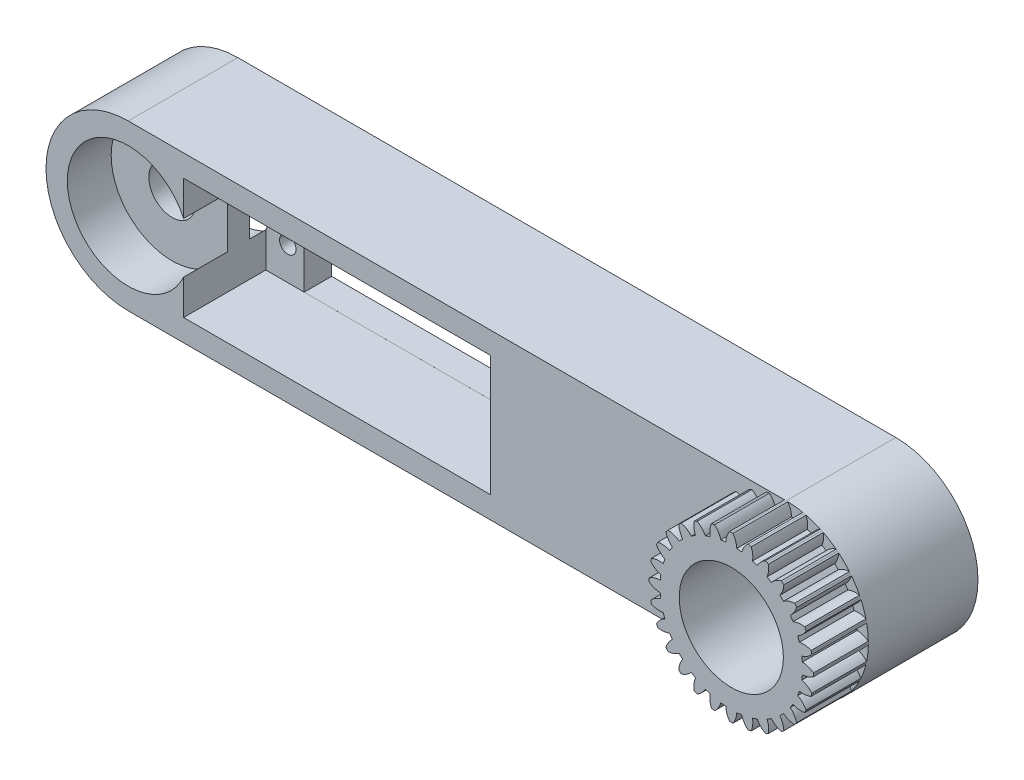
from build123d import *

# Parameters (mm, degrees)
BOSS_EXTRUDE1_DEPTH = 10
SKETCH3_3_R         = 4.25
CUT_EXTRUDE5_DEPTH  = 12
SKETCH3_R           = 4.25
CUT_EXTRUDE6_DEPTH  = 138.295302177
SKETCH4_R           = 4.25
SKETCH4_W           = 42
SKETCH4_H           = 22
CUT_EXTRUDE8_DEPTH  = 138.295302177
SKETCH5_R           = 11.11
CUT_EXTRUDE10_DEPTH = 8
SKETCH7_W           = 56
SKETCH7_H           = 22.002715538
CUT_EXTRUDE12_DEPTH = 15
SKETCH8_R           = 1.5
CUT_EXTRUDE13_DEPTH = 14
SKETCH9_R           = 9.5
CUT_EXTRUDE14_DEPTH = 12
BOSS_EXTRUDE2_START = 10
SKETCH12_R          = 13
SKETCH12_R_2        = 9.5
BOSS_EXTRUDE2_DEPTH = 10
BOSS_EXTRUDE3_START = 10
BOSS_EXTRUDE3_DEPTH = 10
CIRPATTERN1_COUNT   = 28


with BuildPart() as part:
    # Sketch1 → Boss-Extrude1 (new, symmetric)
    with BuildSketch(Plane.XY):
        with BuildLine():
            Line((120, 15), (0, 15))
            ThreePointArc((0, 15), (-15, 0), (0, -15))
            Line((0, -15), (120, -15))
            ThreePointArc((120, -15), (135, 0), (120, 15))
        make_face()
    extrude(amount=BOSS_EXTRUDE1_DEPTH, both=True)

    # Sketch3<3> → Cut-Extrude5 (cut)
    with BuildSketch(Plane.XY.offset(10)):
        with BuildLine():
            Line((120, 7.5), (118.514851485, 7.351485149))
            ThreePointArc((118.514851485, 7.351485149), (112.5, 0), (118.514851485, -7.351485149))
            Line((118.514851485, -7.351485149), (120, -7.5))
            ThreePointArc((120, -7.5), (125.303300859, -5.303300859), (127.5, 0))
            ThreePointArc((127.5, 0), (125.303300859, 5.303300859), (120, 7.5))
        make_face()
        with Locations((120, 0)):
            Circle(SKETCH3_3_R, mode=Mode.SUBTRACT)
    extrude(amount=-CUT_EXTRUDE5_DEPTH, mode=Mode.SUBTRACT)

    # Sketch3 → Cut-Extrude6 (cut, through all)
    with BuildSketch(Plane.XY.offset(10)):
        with Locations((120, 0)):
            Circle(SKETCH3_R)
    extrude(amount=-CUT_EXTRUDE6_DEPTH, mode=Mode.SUBTRACT)

    # Sketch4 → Cut-Extrude8 (cut, through all)
    with BuildSketch(Plane.XY.offset(10)):
        Circle(SKETCH4_R)
        with Locations((38.1, 0)):
            Rectangle(SKETCH4_W, SKETCH4_H)
    extrude(amount=-CUT_EXTRUDE8_DEPTH, mode=Mode.SUBTRACT)

    # Sketch5 → Cut-Extrude10 (cut)
    with BuildSketch(Plane(origin=(0, 0, -10), x_dir=(-1, 0, 0), z_dir=(0, 0, -1))):
        Circle(SKETCH5_R)
    cut_extrude10 = extrude(amount=-CUT_EXTRUDE10_DEPTH, mode=Mode.SUBTRACT)

    # Mirror2: Cut-Extrude10 across plane
    add(cut_extrude10.mirror(Plane.XY), mode=Mode.SUBTRACT)

    # Sketch7 → Cut-Extrude12 (cut)
    with BuildSketch(Plane.XY.offset(10)):
        with Locations((38.1, 0)):
            Rectangle(SKETCH7_W, SKETCH7_H)
    extrude(amount=-CUT_EXTRUDE12_DEPTH, mode=Mode.SUBTRACT)

    # Sketch8 → Cut-Extrude13 (cut)
    with BuildSketch(Plane.XY.offset(-5)):
        with Locations((14.1, 5)):
            Circle(SKETCH8_R)
        with Locations((14.1, -5)):
            Circle(SKETCH8_R)
        with Locations((62.1, -5)):
            Circle(SKETCH8_R)
        with Locations((62.1, 5)):
            Circle(SKETCH8_R)
    extrude(amount=-CUT_EXTRUDE13_DEPTH, mode=Mode.SUBTRACT)

    # Sketch9 → Cut-Extrude14 (cut)
    with BuildSketch(Plane.XY.offset(10)):
        with Locations((120, 0)):
            Circle(SKETCH9_R)
    extrude(amount=-CUT_EXTRUDE14_DEPTH, mode=Mode.SUBTRACT)

    # Sketch12 → Boss-Extrude2 (add)
    with BuildSketch(Plane.XY.offset(10).offset(BOSS_EXTRUDE2_START)):
        with Locations((120, 0)):
            Circle(SKETCH12_R)
        with Locations((120, 0)):
            Circle(SKETCH12_R_2, mode=Mode.SUBTRACT)
    extrude(amount=-BOSS_EXTRUDE2_DEPTH)

    # Sketch12<5> → Boss-Extrude3 (add)
    with BuildSketch(Plane.XY.offset(10).offset(BOSS_EXTRUDE3_START)):
        with BuildLine():
            ThreePointArc((120.302184784, 14.996955836), (120.151100058, 14.99923894), (120, 15))
            Line((120, 15), (119.7, 15))
            ThreePointArc((119.7, 15), (119.2, 14.03224869), (119, 12.961481397))
            ThreePointArc((119, 12.961481397), (120, 13), (121, 12.961481397))
            ThreePointArc((121, 12.961481397), (120.800608022, 14.030476584), (120.302184784, 14.996955836))
        make_face()
    boss_extrude3 = extrude(amount=-BOSS_EXTRUDE3_DEPTH)

    # CirPattern1: Boss-Extrude3 ×28 about axis
    cirpattern1_axis = Axis((120, 0, 0), (0, 0, 1))
    for i in range(1, CIRPATTERN1_COUNT):
        add(boss_extrude3.rotate(cirpattern1_axis, i * 360 / CIRPATTERN1_COUNT))


solid = part.part
